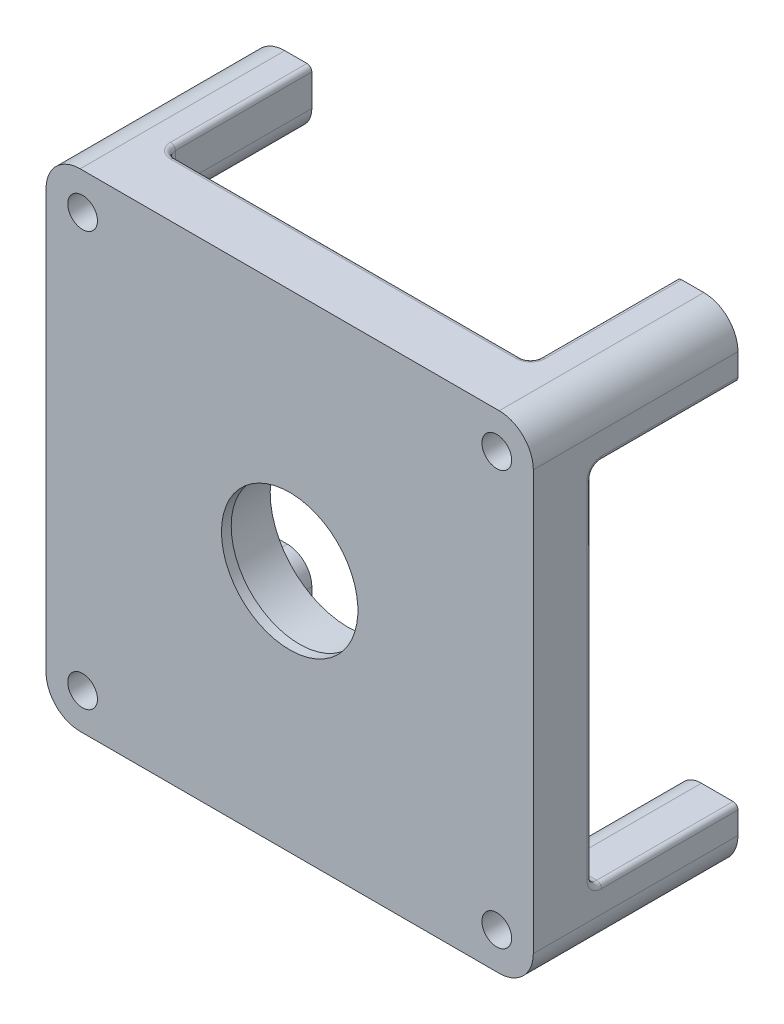
from build123d import *

# Parameters (mm, degrees)
SKETCH2_W            = 100
SKETCH2_H            = 100
BOSS_EXTRUDE1_DEPTH  = 12
SKETCH3_R            = 16
CUT_EXTRUDE1_DEPTH   = 10
M6_CLEARANCE_HOLE1_D = 6.1
BOSS_EXTRUDE2_START  = 30
SKETCH17_R           = 3.05
BOSS_EXTRUDE2_DEPTH  = 30
CIRPATTERN1_COUNT    = 4
SKETCH18_R           = 14
CUT_EXTRUDE3_DEPTH   = 77.811457479
FILLET1_R            = 2
FILLET2_R            = 7
FILLET3_R            = 1


with BuildPart() as part:
    # Sketch2 → Boss-Extrude1 (new body)
    with BuildSketch(Plane.XY):
        Rectangle(SKETCH2_W, SKETCH2_H)
    extrude(amount=BOSS_EXTRUDE1_DEPTH)

    # Sketch3 → Cut-Extrude1 (cut)
    with BuildSketch(Plane(origin=(0, 0, 0), x_dir=(-1, 0, 0), z_dir=(0, 0, -1))):
        Circle(SKETCH3_R)
    extrude(amount=-CUT_EXTRUDE1_DEPTH, mode=Mode.SUBTRACT)

    # M6 Clearance Hole1 (through all)
    with Locations(Plane(origin=(0, 0, 12), x_dir=(-1, 0, 0), z_dir=(0, 0, 1))):
        with Locations((42.5, -42.5), (-42.5, 42.5), (-42.5, -42.5), (42.5, 42.5)):
            Hole(M6_CLEARANCE_HOLE1_D / 2)

    # Sketch17 → Boss-Extrude2 (add)
    with BuildSketch(Plane(origin=(0, 0, 0), x_dir=(-1, 0, 0), z_dir=(0, 0, -1)).offset(BOSS_EXTRUDE2_START)):
        with BuildLine():
            Line((-37.45, 42.5), (-37.45, 50))
            Line((-37.45, 50), (-50, 50))
            Line((-50, 50), (-50, 37.45))
            Line((-50, 37.45), (-42.5, 37.45))
            ThreePointArc((-42.5, 37.45), (-38.929110755, 38.929110755), (-37.45, 42.5))
        make_face()
        with Locations((-42.5, 42.5)):
            Circle(SKETCH17_R, mode=Mode.SUBTRACT)
    boss_extrude2 = extrude(amount=-BOSS_EXTRUDE2_DEPTH)

    # CirPattern1: Boss-Extrude2 ×4 about axis
    cirpattern1_axis = Axis((0, 0, -0.635), (0, 0, 1))
    for i in range(1, CIRPATTERN1_COUNT):
        add(boss_extrude2.rotate(cirpattern1_axis, i * 360 / CIRPATTERN1_COUNT))

    # Sketch18 → Cut-Extrude3 (cut, through all)
    with BuildSketch(Plane(origin=(0, 0, 0), x_dir=(-1, 0, 0), z_dir=(0, 0, -1))):
        Circle(SKETCH18_R)
    extrude(amount=-CUT_EXTRUDE3_DEPTH, mode=Mode.SUBTRACT)

    # Fillet1
    fillet1_edges = [part.edges().sort_by_distance(p)[0] for p in [
        (38.929110755, 38.929110755, 0),
        (-38.929110755, 38.929110755, 0),
        (-38.929110755, -38.929110755, 0),
        (38.929110755, -38.929110755, 0),
        (-37.45, 46.25, 0),
        (-46.25, 37.45, 0),
        (-46.25, -37.45, 0),
        (-37.45, -46.25, 0),
        (37.45, -46.25, 0),
        (46.25, -37.45, 0),
        (46.25, 37.45, 0),
        (37.45, 46.25, 0),
    ]]
    fillet(fillet1_edges, radius=FILLET1_R)

    # Fillet2
    fillet2_edges = [part.edges().sort_by_distance(p)[0] for p in [
        (-50, -50, -9),
        (50, -50, -9),
        (50, 50, -9),
        (-50, 50, -9),
    ]]
    fillet(fillet2_edges, radius=FILLET2_R)

    # Fillet3
    fillet3_edges = [part.edges().sort_by_distance(p)[0] for p in [
        (-36.864213562, -50, -0.585786438),
        (36.864213562, -50, -0.585786438),
        (-50, 36.864213562, -0.585786438),
        (-50, -36.864213562, -0.585786438),
        (-36.864213562, 50, -0.585786438),
        (0, 50, 0),
        (36.864213562, 50, -0.585786438),
        (50, -36.864213562, -0.585786438),
        (50, 0, 0),
        (50, 36.864213562, -0.585786438),
        (0, -50, 0),
        (-50, 0, 0),
        (37.45, 50, -16),
        (50, 37.45, -16),
    ]]
    fillet(fillet3_edges, radius=FILLET3_R)


solid = part.part
